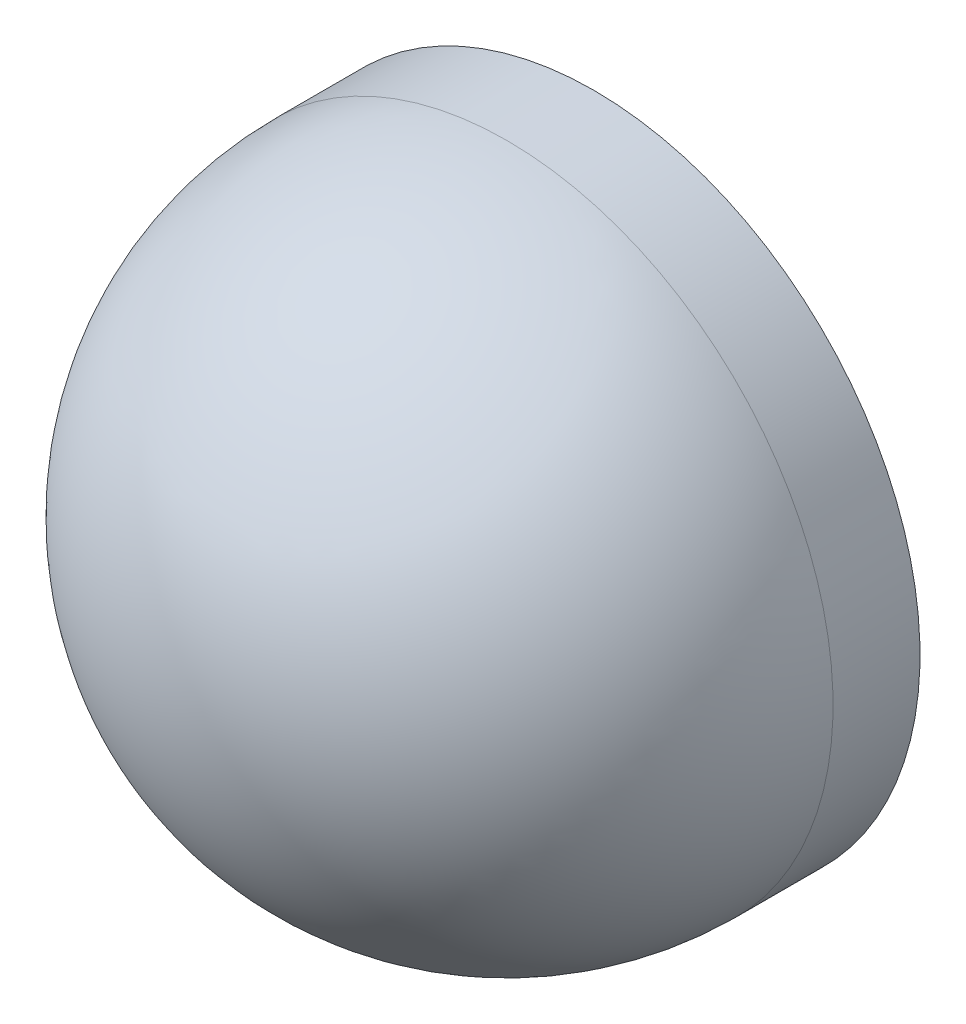
from build123d import *

# Parameters (mm, degrees)
SKIZZE3_W                       = 3.3
SKIZZE3_H                       = 2.9
SCHNITT_LINEAR_AUSTRAGEN1_DEPTH = 2.5


with BuildPart() as part:
    # Skizze2 → Rotation2 (revolve)
    with BuildSketch(Plane(origin=(0, 0, 0), x_dir=(0, 0, -1), z_dir=(1, 0, 0))):
        with BuildLine():
            Line((-0.8, 3), (0, 3))
            Line((0, 3), (0, 0))
            Line((0, 0), (-3.8, 0))
            ThreePointArc((-3.8, 0), (-2.921320344, 2.121320344), (-0.8, 3))
        make_face()
    revolve(axis=Axis((0, 0, 0.8), (0, 0, 1)))

    # Skizze3 → Schnitt-Linear austragen1 (cut)
    with BuildSketch(Plane(origin=(0, 0, 0), x_dir=(-1, 0, 0), z_dir=(0, 0, -1))):
        Rectangle(SKIZZE3_W, SKIZZE3_H)
    extrude(amount=-SCHNITT_LINEAR_AUSTRAGEN1_DEPTH, mode=Mode.SUBTRACT)


solid = part.part
